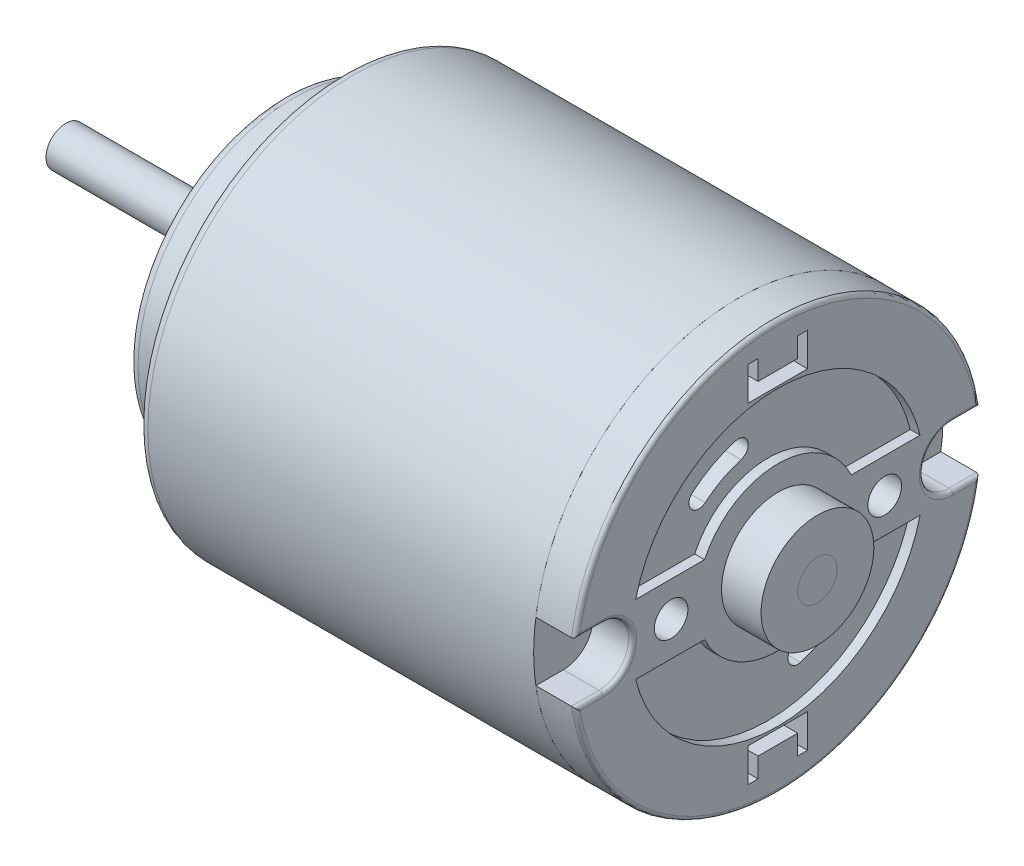
from build123d import *

# Parameters (mm, degrees)
SKETCH1_R           = 10.35
BOSS_EXTRUDE1_DEPTH = 23
SKETCH2_R           = 2.85
BOSS_EXTRUDE2_DEPTH = 4
SKETCH3_R           = 1
CUT_EXTRUDE1_DEPTH  = 31.712293955
SKETCH4_OUTSIDE_W   = 30.664
SKETCH4_OUTSIDE_H   = 30.664
SKETCH4_OUTSIDE_R   = 7.85
CUT_EXTRUDE2_DEPTH  = 3
FILLET1_R           = 0.5
SKETCH5_R           = 3
SKETCH5_R_2         = 1
BOSS_EXTRUDE3_DEPTH = 2
SKETCH6_R           = 1
CUT_EXTRUDE3_DEPTH  = 3
SKETCH7_R           = 10.35
SKETCH7_R_2         = 2.85
BOSS_EXTRUDE4_DEPTH = 2
CUT_EXTRUDE4_DEPTH  = 2
SKETCH9_R           = 0.85
CUT_EXTRUDE5_DEPTH  = 2
CUT_EXTRUDE6_DEPTH  = 2
FILLET2_R           = 0.2
CUT_EXTRUDE7_DEPTH  = 0.5
SKETCH12_R          = 1
BOSS_EXTRUDE5_DEPTH = 38


with BuildPart() as part:
    # Sketch1 → Boss-Extrude1 (new body)
    with BuildSketch(Plane(origin=(0, 0, 0), x_dir=(0, 0, -1), z_dir=(1, 0, 0))):
        Circle(SKETCH1_R)
    extrude(amount=BOSS_EXTRUDE1_DEPTH)

    # Sketch2 → Boss-Extrude2 (add)
    with BuildSketch(Plane(origin=(23, 0, 0), x_dir=(0, 0, -1), z_dir=(1, 0, 0))):
        Circle(SKETCH2_R)
    extrude(amount=BOSS_EXTRUDE2_DEPTH)

    # Sketch3 → Cut-Extrude1 (cut, through all)
    with BuildSketch(Plane(origin=(27, 0, 0), x_dir=(0, 0, -1), z_dir=(1, 0, 0))):
        Circle(SKETCH3_R)
    extrude(amount=-CUT_EXTRUDE1_DEPTH, mode=Mode.SUBTRACT)

    # Sketch4 outside → Cut-Extrude2 (cut)
    with BuildSketch(Plane.ZY):
        Rectangle(SKETCH4_OUTSIDE_W, SKETCH4_OUTSIDE_H)
        Circle(SKETCH4_OUTSIDE_R, mode=Mode.SUBTRACT)
    extrude(amount=-CUT_EXTRUDE2_DEPTH, mode=Mode.SUBTRACT)

    # Fillet1
    fillet1_edges = [part.edges().sort_by_distance(p)[0] for p in [
        (3, 0, -7.85),
        (3, 0, 10.35),
        (0, 0, -7.85),
    ]]
    fillet(fillet1_edges, radius=FILLET1_R)

    # Sketch5 → Boss-Extrude3 (add)
    with BuildSketch(Plane.ZY):
        with Locations(Location((0, 0, 0), (0, 0, 180))):
            Circle(SKETCH5_R)
        with Locations(Location((0, 0, 0), (0, 0, 180))):
            Circle(SKETCH5_R_2, mode=Mode.SUBTRACT)
    extrude(amount=BOSS_EXTRUDE3_DEPTH)

    # Sketch6 → Cut-Extrude3 (cut)
    with BuildSketch(Plane.ZY):
        with Locations((5, 0)):
            Circle(SKETCH6_R)
        with Locations((-5, 0)):
            Circle(SKETCH6_R)
    extrude(amount=-CUT_EXTRUDE3_DEPTH, mode=Mode.SUBTRACT)


with BuildPart() as body_2:
    # Sketch7 → Boss-Extrude4 (new body)
    with BuildSketch(Plane(origin=(23, 0, 0), x_dir=(0, 0, -1), z_dir=(1, 0, 0))):
        Circle(SKETCH7_R)
        Circle(SKETCH7_R_2, mode=Mode.SUBTRACT)
    extrude(amount=BOSS_EXTRUDE4_DEPTH)

    # Sketch8 → Cut-Extrude4 (cut)
    with BuildSketch(Plane(origin=(25, 0, 0), x_dir=(0, 0, -1), z_dir=(1, 0, 0))):
        with BuildLine():
            Line((-8.85, 1.5), (-12.584391225, 1.5))
            Line((-12.584391225, 1.5), (-12.584391225, -1.5))
            Line((-12.584391225, -1.5), (-8.85, -1.5))
            ThreePointArc((-8.85, -1.5), (-7.35, 0), (-8.85, 1.5))
        make_face()
        with BuildLine():
            Line((12.584391225, -1.5), (8.85, -1.5))
            ThreePointArc((8.85, -1.5), (7.35, 0), (8.85, 1.5))
            Line((8.85, 1.5), (12.584391225, 1.5))
            Line((12.584391225, 1.5), (12.584391225, -1.5))
        make_face()
    extrude(amount=-CUT_EXTRUDE4_DEPTH, mode=Mode.SUBTRACT)

    # Sketch9 → Cut-Extrude5 (cut)
    with BuildSketch(Plane(origin=(25, 0, 0), x_dir=(0, 0, -1), z_dir=(1, 0, 0))):
        with Locations((-5.4, 0)):
            Circle(SKETCH9_R)
        with Locations((5.4, 0)):
            Circle(SKETCH9_R)
        with BuildLine():
            ThreePointArc((-1.638888889, 5.667807619), (-2.793935036, 5.196530286), (-3.824074074, 4.492934172))
            ThreePointArc((-3.824074074, 4.492934172), (-3.880757133, 3.788102965), (-3.175925926, 3.731419906))
            ThreePointArc((-3.175925926, 3.731419906), (-2.320386725, 4.315762441), (-1.361111111, 4.70716226))
            ThreePointArc((-1.361111111, 4.70716226), (-1.01967732, 5.326373829), (-1.638888889, 5.667807619))
        make_face()
        with BuildLine():
            ThreePointArc((1.638888889, -5.667807619), (2.793935036, -5.196530286), (3.824074074, -4.492934172))
            ThreePointArc((3.824074074, -4.492934172), (3.880757133, -3.788102965), (3.175925926, -3.731419906))
            ThreePointArc((3.175925926, -3.731419906), (2.320386725, -4.315762441), (1.361111111, -4.70716226))
            ThreePointArc((1.361111111, -4.70716226), (1.01967732, -5.326373829), (1.638888889, -5.667807619))
        make_face()
    extrude(amount=-CUT_EXTRUDE5_DEPTH, mode=Mode.SUBTRACT)

    # Sketch10 → Cut-Extrude6 (cut)
    with BuildSketch(Plane(origin=(25, 0, 0), x_dir=(0, 0, -1), z_dir=(1, 0, 0))):
        Polygon((-1.5, 9.2), (-1.5, 7.5), (1.5, 7.5), (1.5, 9.2), (1, 9.2), (1, 8.2), (-1, 8.2), (-1, 9.2), align=None)
        Polygon((1.5, -9.2), (1.5, -7.5), (-1.5, -7.5), (-1.5, -9.2), (-1, -9.2), (-1, -8.2), (1, -8.2), (1, -9.2), align=None)
    extrude(amount=-CUT_EXTRUDE6_DEPTH, mode=Mode.SUBTRACT)

    # Fillet2
    fillet2_edges = [body_2.edges().sort_by_distance(p)[0] for p in [
        (25, -10.35, 0),
        (25, 1.5, 9.545363757),
        (25, -1.5, 9.545363757),
        (25, 0, 7.35),
        (25, 1.5, -9.545363757),
        (25, 0, -7.35),
        (25, -1.5, -9.545363757),
        (25, 10.35, 0),
    ]]
    fillet(fillet2_edges, radius=FILLET2_R)

    # Sketch11 → Cut-Extrude7 (cut)
    with BuildSketch(Plane(origin=(25, 0, 0), x_dir=(0, 0, -1), z_dir=(1, 0, 0))):
        with BuildLine():
            Line((-7.190097357, 1.75), (-3.707762128, 1.75))
            ThreePointArc((-3.707762128, 1.75), (0, 4.1), (3.707762128, 1.75))
            Line((3.707762128, 1.75), (7.190097357, 1.75))
            ThreePointArc((7.190097357, 1.75), (0, 7.4), (-7.190097357, 1.75))
        make_face()
        with BuildLine():
            Line((7.190097357, -1.75), (3.707762128, -1.75))
            ThreePointArc((3.707762128, -1.75), (0, -4.1), (-3.707762128, -1.75))
            Line((-3.707762128, -1.75), (-7.190097357, -1.75))
            ThreePointArc((-7.190097357, -1.75), (0, -7.4), (7.190097357, -1.75))
        make_face()
    extrude(amount=-CUT_EXTRUDE7_DEPTH, mode=Mode.SUBTRACT)


with BuildPart() as body_3:
    # Sketch12 → Boss-Extrude5 (new body)
    with BuildSketch(Plane(origin=(27, 0, 0), x_dir=(0, 0, -1), z_dir=(1, 0, 0))):
        Circle(SKETCH12_R)
    extrude(amount=-BOSS_EXTRUDE5_DEPTH)


solid = Compound([part.part, body_2.part, body_3.part])
